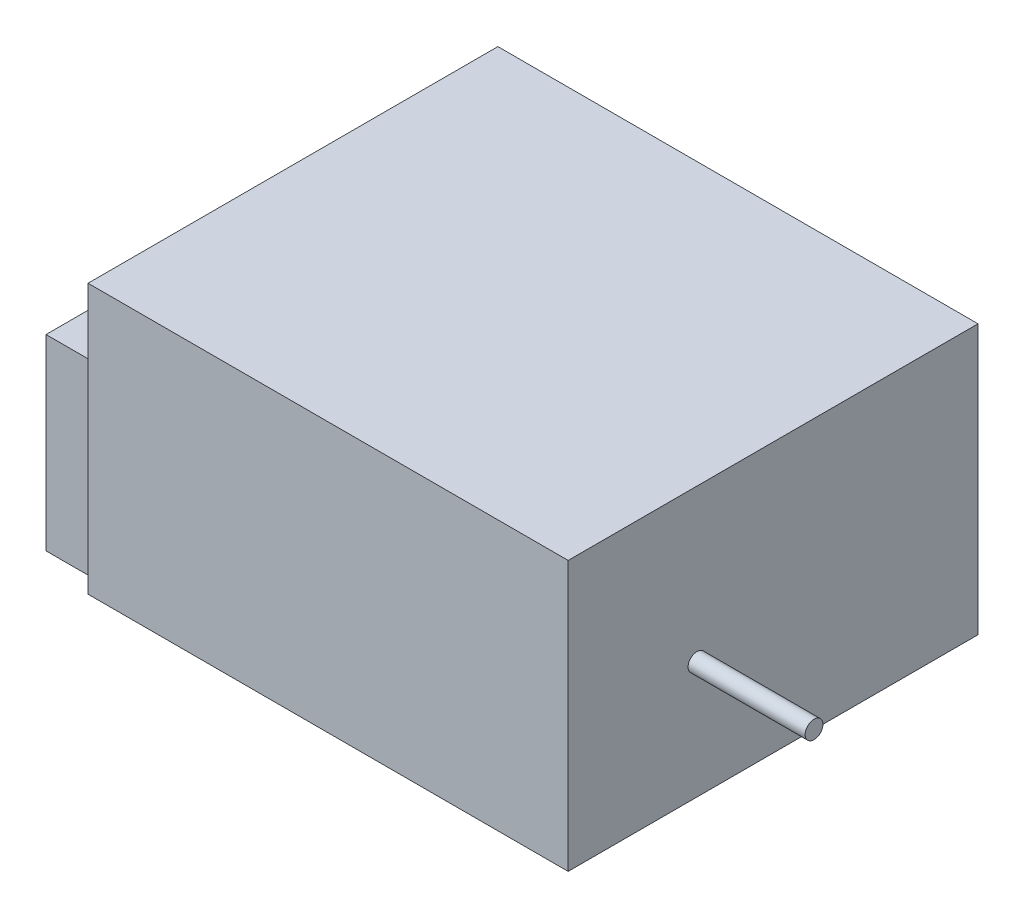
from build123d import *

# Parameters (mm, degrees)
SKETCH1_W           = 104.14
SKETCH1_H           = 88.9
BOSS_EXTRUDE1_DEPTH = 58.42
SKETCH2_W           = 40.64
SKETCH2_H           = 40.64
BOSS_EXTRUDE2_DEPTH = 12.7
SKETCH3_R           = 1.927464999
BOSS_EXTRUDE3_DEPTH = 25.4
SKETCH4_R           = 2.682066204
BOSS_EXTRUDE4_DEPTH = 25.4


with BuildPart() as part:
    # Sketch1 → Boss-Extrude1 (new body)
    with BuildSketch(Plane(origin=(0, 0, 0), x_dir=(1, 0, 0), z_dir=(0, 1, 0))):
        Rectangle(SKETCH1_W, SKETCH1_H)
    extrude(amount=BOSS_EXTRUDE1_DEPTH)

    # Sketch2 → Boss-Extrude2 (add)
    with BuildSketch(Plane.ZY.offset(52.07)):
        with Locations((20.544561746, 20.32)):
            Rectangle(SKETCH2_W, SKETCH2_H)
    extrude(amount=BOSS_EXTRUDE2_DEPTH)

    # Sketch3 → Boss-Extrude3 (add)
    with BuildSketch(Plane(origin=(52.07, 0, 0), x_dir=(0, 0, -1), z_dir=(1, 0, 0))):
        with Locations(Location((-16.51, 25.4, 0), (0, 0, 180))):
            Circle(SKETCH3_R)
    extrude(amount=BOSS_EXTRUDE3_DEPTH)

    # Sketch4 → Boss-Extrude4 (add)
    with BuildSketch(Plane.ZY.offset(52.07)):
        with Locations(Location((-39.37, 25.4, 0), (0, 0, 180))):
            Circle(SKETCH4_R)
    extrude(amount=BOSS_EXTRUDE4_DEPTH)


solid = part.part
